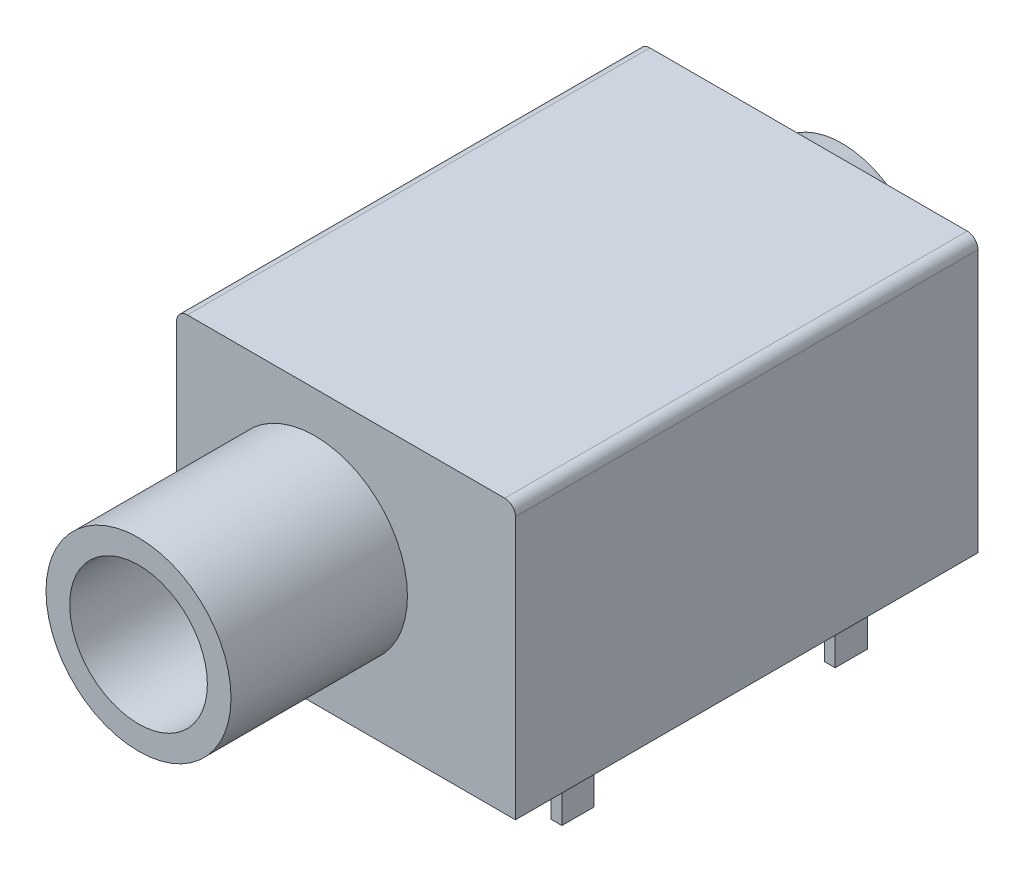
from build123d import *

# Parameters (mm, degrees)
BOSS_EXTRUDE1_DEPTH = 21.5
SKETCH2_R           = 4.3
BOSS_EXTRUDE2_DEPTH = 8.2
SKETCH8_R           = 4.3
BOSS_EXTRUDE3_DEPTH = 3
BOSS_EXTRUDE3_TAPER = 9
SKETCH7_R           = 3.2
CUT_EXTRUDE1_DEPTH  = 31
SKETCH9_W           = 0.5
SKETCH9_H           = 1.5
BOSS_EXTRUDE4_DEPTH = 3.15


with BuildPart() as part:
    # Sketch1 → Boss-Extrude1 (new body)
    with BuildSketch(Plane.XY):
        with BuildLine():
            Line((0, 0), (15.75, 0))
            Line((15.75, 0), (15.75, 12.2))
            ThreePointArc((15.75, 12.2), (15.603553391, 12.553553391), (15.25, 12.7))
            Line((15.25, 12.7), (0.5, 12.7))
            ThreePointArc((0.5, 12.7), (0.146446609, 12.553553391), (0, 12.2))
            Line((0, 12.2), (0, 0))
        make_face()
    extrude(amount=-BOSS_EXTRUDE1_DEPTH)

    # Sketch2 → Boss-Extrude2 (add)
    with BuildSketch(Plane.XY):
        with Locations((6.43, 6.5)):
            Circle(SKETCH2_R)
    extrude(amount=BOSS_EXTRUDE2_DEPTH)

    # Sketch8 → Boss-Extrude3 (add)
    with BuildSketch(Plane(origin=(0, 0, -21.5), x_dir=(-1, 0, 0), z_dir=(0, 0, -1))):
        with Locations(Location((-6.43, 6.5, 0), (0, 0, 180))):
            Circle(SKETCH8_R)
    extrude(amount=BOSS_EXTRUDE3_DEPTH, taper=BOSS_EXTRUDE3_TAPER)

    # Sketch7 → Cut-Extrude1 (cut)
    with BuildSketch(Plane.XY.offset(8.2)):
        with Locations((6.43, 6.5)):
            Circle(SKETCH7_R)
    extrude(amount=-CUT_EXTRUDE1_DEPTH, mode=Mode.SUBTRACT)

    # Sketch9 → Boss-Extrude4 (add)
    with BuildSketch(Plane.XZ):
        with Locations((2.23, -4.75)):
            Rectangle(SKETCH9_W, SKETCH9_H)
        with Locations((13.66, -4.75)):
            Rectangle(SKETCH9_W, SKETCH9_H)
        with Locations((2.23, -17.45)):
            Rectangle(SKETCH9_W, SKETCH9_H)
        with Locations((13.66, -17.45)):
            Rectangle(SKETCH9_W, SKETCH9_H)
    extrude(amount=BOSS_EXTRUDE4_DEPTH)


solid = part.part
